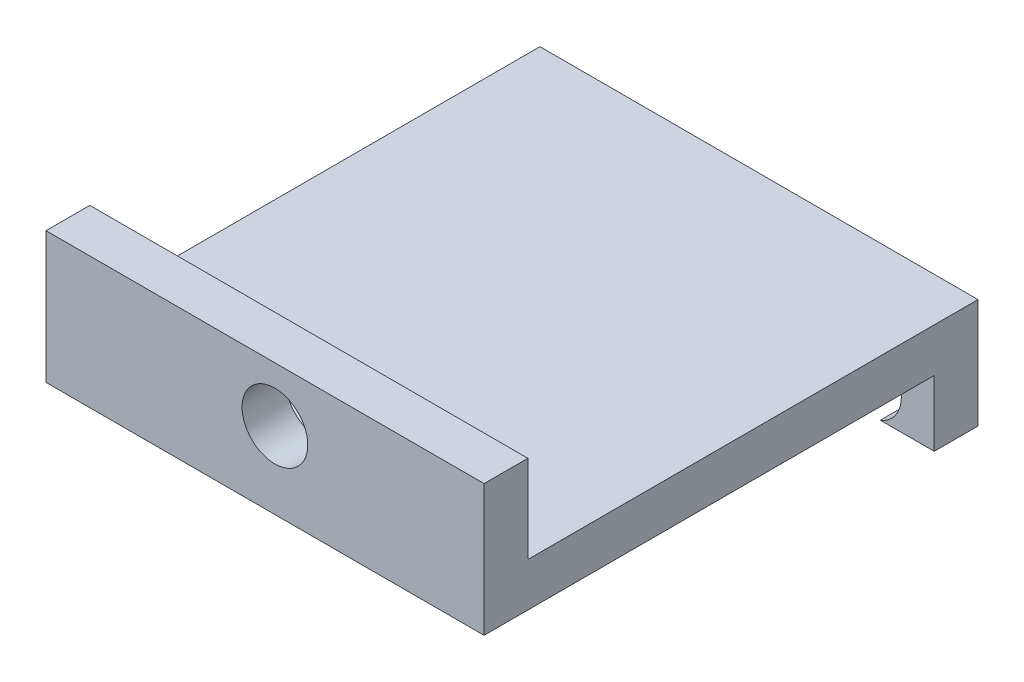
from build123d import *

# Parameters (mm, degrees)
BOSS_EXTRU_2_DEPTH      = 2
ESQUISSE2_W             = 20
ESQUISSE2_H             = 2
BOSS_EXTRU_3_DEPTH      = 20.55
ESQUISSE3_W             = 20
ESQUISSE3_H             = 2
BOSS_EXTRU_4_DEPTH      = 4
ESQUISSE4_R             = 1.5
ENL_V_MAT_EXTRU_1_DEPTH = 4


with BuildPart() as part:
    # Esquisse1 → Boss.-Extru.2 (new body)
    with BuildSketch(Plane.XY):
        with BuildLine():
            Line((-10, 2.5), (-10, -2.5))
            Line((-10, -2.5), (-7.538516481, -2.5))
            ThreePointArc((-7.538516481, -2.5), (-7.849183513, 0.136481848), (-5.5, -1.1))
            ThreePointArc((-5.5, -1.1), (-5.763518152, -1.949183513), (-6.461483519, -2.5))
            Line((-6.461483519, -2.5), (6.461483519, -2.5))
            ThreePointArc((6.461483519, -2.5), (6.150816487, 0.136481848), (8.5, -1.1))
            ThreePointArc((8.5, -1.1), (8.236481848, -1.949183513), (7.538516481, -2.5))
            Line((7.538516481, -2.5), (10, -2.5))
            Line((10, -2.5), (10, 2.5))
            Line((10, 2.5), (-10, 2.5))
        make_face()
    extrude(amount=BOSS_EXTRU_2_DEPTH)

    # Esquisse2 → Boss.-Extru.3 (add)
    with BuildSketch(Plane.XY.offset(2)):
        with Locations((0, 1.5)):
            Rectangle(ESQUISSE2_W, ESQUISSE2_H)
    extrude(amount=BOSS_EXTRU_3_DEPTH)

    # Esquisse3 → Boss.-Extru.4 (add)
    with BuildSketch(Plane(origin=(0, 2.5, 0), x_dir=(1, 0, 0), z_dir=(0, 1, 0))):
        with Locations((0, -21.55)):
            Rectangle(ESQUISSE3_W, ESQUISSE3_H)
    extrude(amount=BOSS_EXTRU_4_DEPTH)

    # Esquisse4 → Enlèv. mat.-Extru.1 (cut)
    with BuildSketch(Plane.XY.offset(22.55)):
        with Locations((0.45, 4)):
            Circle(ESQUISSE4_R)
    extrude(amount=-ENL_V_MAT_EXTRU_1_DEPTH, mode=Mode.SUBTRACT)


solid = part.part
